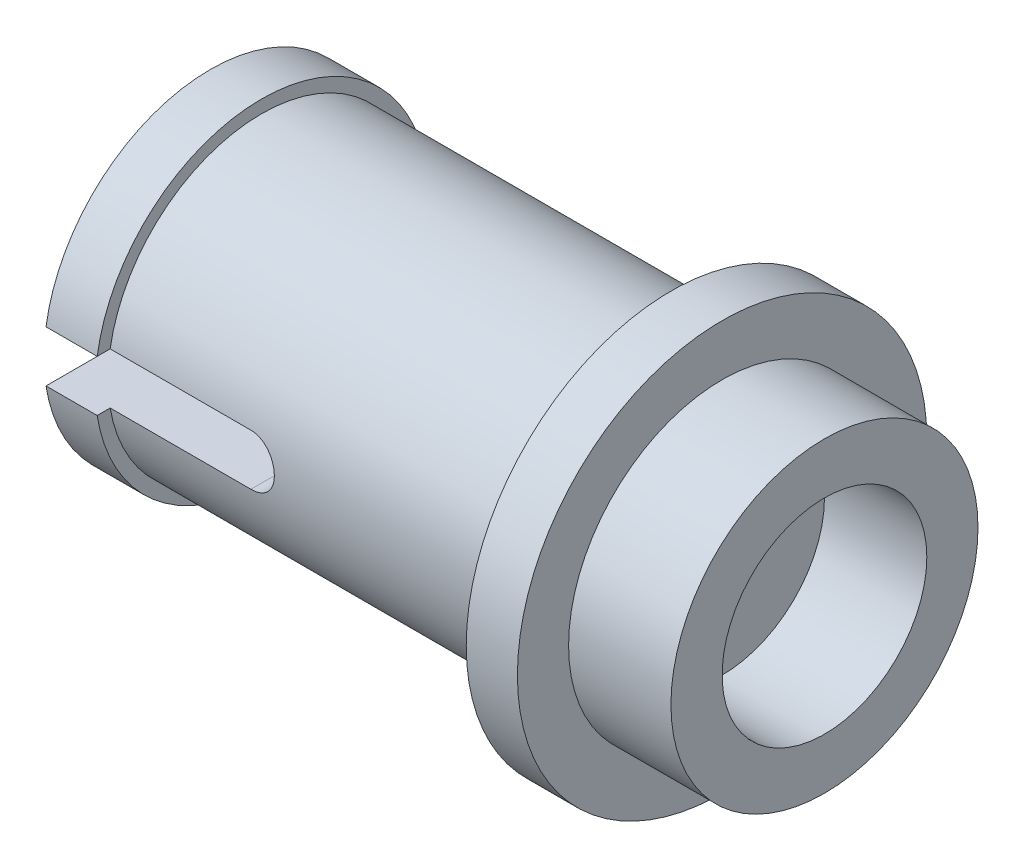
from build123d import *
from build123d.topology import SkipClean

# Parameters (mm, degrees)
SKETCH1_W                      = 4.2
SKETCH1_H                      = 2.4
F_0_8_0_8_DIAMETER_HOLE1_D     = 0.8
SKETCH6_R                      = 3.2
BOSS_EXTRUDE1_DEPTH            = 0.8
BOSS_EXTRUDE2_DEPTH            = 3
CUT_EXTRUDE1_DEPTH             = 2.2
BOSS_EXTRUDE3_DEPTH            = 2.2
BOSS_EXTRUDE4_DEPTH            = 0.8
BOSS_EXTRUDE5_START            = 1.6
SKETCH11_R                     = 2.4
BOSS_EXTRUDE5_DEPTH            = 1.6
SKETCH16_W                     = 7.2
SKETCH16_H                     = 1.6
F_3_2_3_2_DIAMETER_HOLE1_D     = 3.2
F_3_2_3_2_DIAMETER_HOLE1_DEPTH = 1.6


with BuildPart() as part:
    # Sketch1 → Revolve1 (revolve)
    with BuildSketch(Plane.XY):
        with Locations((-2.9, 1.2)):
            Rectangle(SKETCH1_W, SKETCH1_H)
    revolve(axis=Axis((-5, 0, 0), (1, 0, 0)))

    # Ø0.8 (0.8) Diameter Hole1 (through all)
    with Locations(Plane(origin=(-5, 0, -2.4), x_dir=(0, -1, 0), z_dir=(0, 0, -1))):
        with Locations((0, 0)):
            Hole(F_0_8_0_8_DIAMETER_HOLE1_D / 2)

    # Sketch6 → Boss-Extrude1 (add)
    with BuildSketch(Plane.ZY.offset(0.8)):
        Circle(SKETCH6_R)
    extrude(amount=-BOSS_EXTRUDE1_DEPTH)

    # Sketch7 → Boss-Extrude2 (add)
    with BuildSketch(Plane.ZY.offset(5)):
        with BuildLine():
            Line((-2.569046516, -0.4), (2.569046516, -0.4))
            ThreePointArc((2.569046516, -0.4), (0, -2.6), (-2.569046516, -0.4))
        make_face()
    extrude(amount=BOSS_EXTRUDE2_DEPTH)

    # Sketch8 → Cut-Extrude1 (cut)
    with SkipClean():  # the faces are left unmerged after this step: merging them gives an invalid solid
        with BuildSketch(Plane(origin=(-5, 0, 0), x_dir=(0, 0, -1), z_dir=(1, 0, 0))):
            with BuildLine():
                Line((2.569046516, -0.4), (2.366431913, -0.4))
                ThreePointArc((2.366431913, -0.4), (0, -2.4), (-2.366431913, -0.4))
                Line((-2.366431913, -0.4), (-2.569046516, -0.4))
                ThreePointArc((-2.569046516, -0.4), (0, -2.6), (2.569046516, -0.4))
            make_face()
        extrude(amount=-CUT_EXTRUDE1_DEPTH, mode=Mode.SUBTRACT)

    # Sketch9 → Boss-Extrude3 (add)
    with SkipClean():  # the faces are left unmerged after this step: merging them gives an invalid solid
        with BuildSketch(Plane.ZY.offset(5)):
            with BuildLine():
                Line((2.366431913, 0.4), (-2.366431913, 0.4))
                ThreePointArc((-2.366431913, 0.4), (0, 2.4), (2.366431913, 0.4))
            make_face()
        extrude(amount=BOSS_EXTRUDE3_DEPTH)

    # Sketch10 → Boss-Extrude4 (add)
    with SkipClean():  # the faces are left unmerged after this step: merging them gives an invalid solid
        with BuildSketch(Plane.ZY.offset(7.2)):
            with BuildLine():
                Line((2.569046516, 0.4), (-2.569046516, 0.4))
                ThreePointArc((-2.569046516, 0.4), (0, 2.6), (2.569046516, 0.4))
            make_face()
        extrude(amount=BOSS_EXTRUDE4_DEPTH)

    # Sketch11 → Boss-Extrude5 (add)
    with SkipClean():  # the faces are left unmerged after this step: merging them gives an invalid solid
        with BuildSketch(Plane(origin=(0, 0, 0), x_dir=(0, 0, -1), z_dir=(1, 0, 0)).offset(BOSS_EXTRUDE5_START)):
            with Locations(Location((0, 0, 0), (0, 0, 90))):
                Circle(SKETCH11_R)
        extrude(amount=-BOSS_EXTRUDE5_DEPTH)

    # Sketch16 → Cut-Revolve1 (revolve, cut)
    with SkipClean():  # the faces are left unmerged after this step: merging them gives an invalid solid
        with BuildSketch(Plane(origin=(0, 0, 0), x_dir=(-1, 0, 0), z_dir=(0, 0, -1)), mode=Mode.PRIVATE) as cut_revolve1_sk:
            with Locations((4.4, 0.8)):
                Rectangle(SKETCH16_W, SKETCH16_H)
        revolve(cut_revolve1_sk.sketch.rotate(Axis((-0.8, 0, 0), (-1, 0, 0)), 270), axis=Axis((-0.8, 0, 0), (-1, 0, 0)), mode=Mode.SUBTRACT)

    # Ø3.2 (3.2) Diameter Hole1
    with Locations(Plane(origin=(1.6, 0, 0), x_dir=(0, 0, -1), z_dir=(1, 0, 0))):
        with Locations((0, 0)):
            Hole(F_3_2_3_2_DIAMETER_HOLE1_D / 2, depth=F_3_2_3_2_DIAMETER_HOLE1_DEPTH)


solid = part.part
